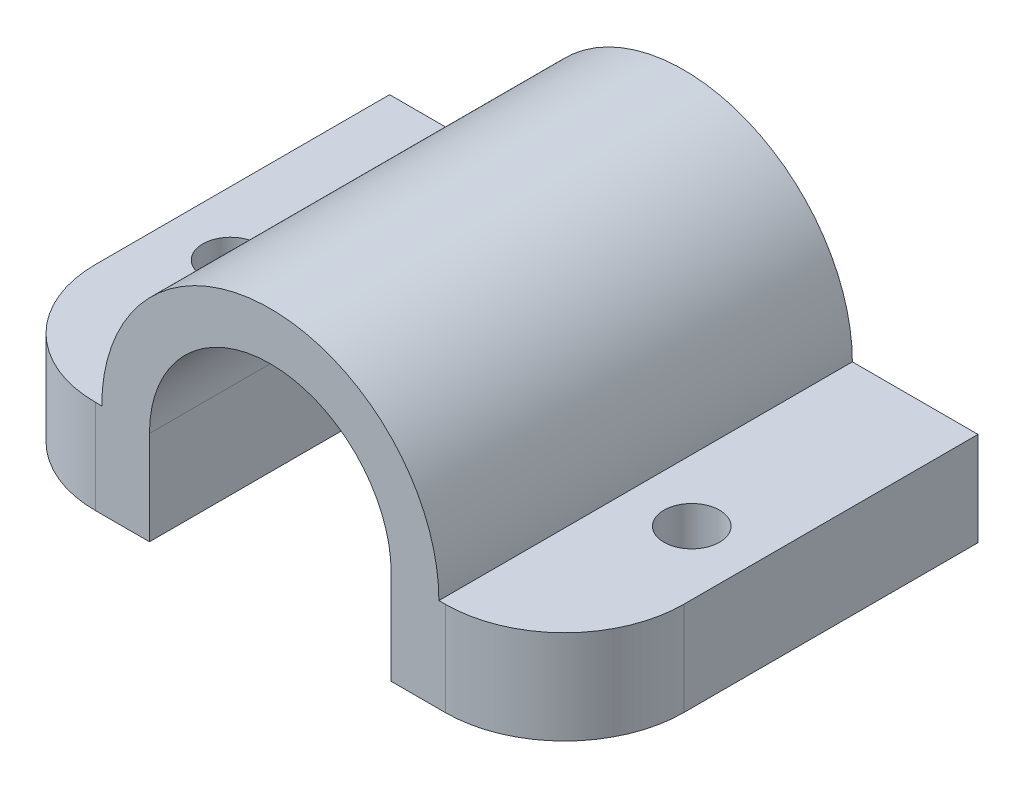
from build123d import *

# Parameters (mm, degrees)
DODANIE_WYCI_GNI_CIE1_DEPTH = 12
DODANIE_WYCI_GNI_CIE2_DEPTH = 2
WYTNIJ_WYCI_GNI_CIE1_REACH  = 27.507
SZKIC3_R                    = 1.75
ZAOKR_GLENIE1_R             = 7.5


with BuildPart() as part:
    # Szkic1 → Dodanie-wyciągnięcie1 (new, symmetric)
    with BuildSketch(Plane.XY):
        with BuildLine():
            ThreePointArc((-10.6, 0), (0, 10.6), (10.6, 0))
            Line((10.6, 0), (18.5, 0))
            Line((18.5, 0), (18.5, -5.9))
            Line((18.5, -5.9), (7.6, -5.9))
            Line((7.6, -5.9), (7.6, 0))
            ThreePointArc((7.6, 0), (0, 7.6), (-7.6, 0))
            Line((-7.6, 0), (-7.6, -5.9))
            Line((-7.6, -5.9), (-18.5, -5.9))
            Line((-18.5, -5.9), (-18.5, 0))
            Line((-18.5, 0), (-10.6, 0))
        make_face()
    extrude(amount=DODANIE_WYCI_GNI_CIE1_DEPTH, both=True)

    # Szkic2 → Dodanie-wyciągnięcie2 (add)
    with BuildSketch(Plane(origin=(0, 0, -12), x_dir=(-1, 0, 0), z_dir=(0, 0, -1))):
        with BuildLine():
            Line((18.5, 0), (10.6, 0))
            ThreePointArc((10.6, 0), (0, 10.6), (-10.6, 0))
            Line((-10.6, 0), (-18.5, 0))
            Line((-18.5, 0), (-18.5, -5.9))
            Line((-18.5, -5.9), (-7.6, -5.9))
            Line((-7.6, -5.9), (-7.6, 0))
            ThreePointArc((-7.6, 0), (0, 7.6), (7.6, 0))
            Line((7.6, 0), (7.6, -5.9))
            Line((7.6, -5.9), (18.5, -5.9))
            Line((18.5, -5.9), (18.5, 0))
        make_face()
        with BuildLine():
            ThreePointArc((4.6, 0), (0, 4.6), (-4.6, 0))
            Line((-4.6, 0), (-4.6, -5.9))
            Line((-4.6, -5.9), (-7.6, -5.9))
            Line((-7.6, -5.9), (-7.6, 0))
            ThreePointArc((-7.6, 0), (0, 7.6), (7.6, 0))
            Line((7.6, 0), (7.6, -5.9))
            Line((7.6, -5.9), (4.6, -5.9))
            Line((4.6, -5.9), (4.6, 0))
        make_face()
    extrude(amount=DODANIE_WYCI_GNI_CIE2_DEPTH)

    # Szkic3 → Wytnij-wyciągnięcie1 (cut, up to next)
    with BuildSketch(Plane(origin=(0, 0, 0), x_dir=(1, 0, 0), z_dir=(0, 1, 0)), mode=Mode.PRIVATE) as wytnij_wyci_gni_cie1_sk1:
        with Locations(Location((-14.5, 0, 0), (0, 0, 270))):
            Circle(SZKIC3_R)
    wytnij_wyci_gni_cie1_tool1 = extrude(wytnij_wyci_gni_cie1_sk1.sketch, amount=-WYTNIJ_WYCI_GNI_CIE1_REACH, mode=Mode.PRIVATE) & part.part
    # Szkic3 → Wytnij-wyciągnięcie1 (cut, up to next)
    with BuildSketch(Plane(origin=(0, 0, 0), x_dir=(1, 0, 0), z_dir=(0, 1, 0)), mode=Mode.PRIVATE) as wytnij_wyci_gni_cie1_sk2:
        with Locations(Location((14.5, 0, 0), (0, 0, 270))):
            Circle(SZKIC3_R)
    wytnij_wyci_gni_cie1_tool2 = extrude(wytnij_wyci_gni_cie1_sk2.sketch, amount=-WYTNIJ_WYCI_GNI_CIE1_REACH, mode=Mode.PRIVATE) & part.part
    add(wytnij_wyci_gni_cie1_tool1.solids().sort_by_distance((-14.5, 0, 0))[0], mode=Mode.SUBTRACT)
    add(wytnij_wyci_gni_cie1_tool2.solids().sort_by_distance((14.5, 0, 0))[0], mode=Mode.SUBTRACT)

    # Zaokrąglenie1
    zaokr_glenie1_edges = [part.edges().sort_by_distance(p)[0] for p in [
        (-18.5, -2.95, 12),
        (18.5, -2.95, 12),
    ]]
    fillet(zaokr_glenie1_edges, radius=ZAOKR_GLENIE1_R)


solid = part.part
